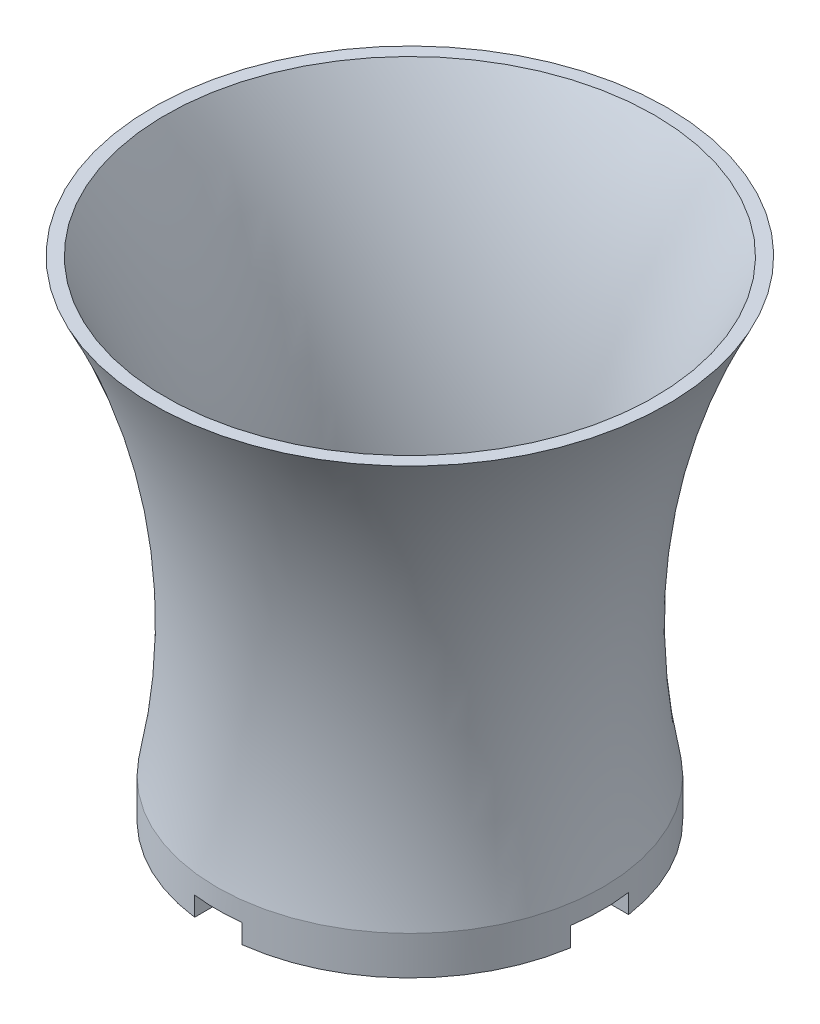
from build123d import *

# Parameters (mm, degrees)
F_9_64_0_14063_DIAMETER_HOLE2_D           = 3.572002
F_9_64_0_14063_DIAMETER_HOLE2_CSINK_D     = 4.842002
F_9_64_0_14063_DIAMETER_HOLE2_CSINK_ANGLE = 100
F_9_64_0_14063_DIAMETER_HOLE3_D           = 3.572002
F_9_64_0_14063_DIAMETER_HOLE3_CSINK_D     = 4.842002
F_9_64_0_14063_DIAMETER_HOLE3_CSINK_ANGLE = 100
CUT_EXTRUDE1_DEPTH                        = 3.81


with BuildPart() as part:
    # Sketch2 → Revolve1 (revolve)
    with BuildSketch(Plane.XY, mode=Mode.PRIVATE) as revolve1_sk:
        with BuildLine():
            Line((0, 0), (-35.56, 0))
            ThreePointArc((-35.56, 0), (-34.441376421, 45.516946226), (-48.26, 88.9))
            Line((-48.26, 88.9), (-50.8, 88.9))
            ThreePointArc((-50.8, 88.9), (-36.890578114, 45.529917412), (-38.1, 0))
            Line((-38.1, 0), (-38.1, -7.62))
            Line((-38.1, -7.62), (0, -7.62))
            Line((0, -7.62), (0, 0))
        make_face()
    revolve(revolve1_sk.sketch.rotate(Axis((0, 0, 0), (0, 1, 0)), 270), axis=Axis((0, 0, 0), (0, 1, 0)))

    # 9/64 (0.14063) Diameter Hole2 (through all)
    with Locations(Plane(origin=(0, 0, 0), x_dir=(1, 0, 0), z_dir=(0, 1, 0))):
        with Locations((0, -28.72641934), (-28.389650063, 0), (0, 28.72641934), (28.120234641, 0), (17.815094761, -20.105125845), (17.815094761, 19.431587291), (-18.421279459, 19.431587291), (-18.421279459, -20.105125845), (0, 0)):
            CounterSinkHole(F_9_64_0_14063_DIAMETER_HOLE2_D / 2, F_9_64_0_14063_DIAMETER_HOLE2_CSINK_D / 2, counter_sink_angle=F_9_64_0_14063_DIAMETER_HOLE2_CSINK_ANGLE)

    # 9/64 (0.14063) Diameter Hole3 (through all)
    with Locations(Plane(origin=(0, -7.62, 0), x_dir=(-1, 0, 0), z_dir=(0, -1, 0))):
        with Locations((-6.364939338, 18.960110303), (7.50995488, 18.960110303), (19.835710423, 7.914078013), (-19.29687958, 7.914078013), (-19.29687958, -8.385555001), (-7.038477892, -21.317495243), (7.914078013, -21.317495243), (19.835710423, -8.857031989)):
            CounterSinkHole(F_9_64_0_14063_DIAMETER_HOLE3_D / 2, F_9_64_0_14063_DIAMETER_HOLE3_CSINK_D / 2, counter_sink_angle=F_9_64_0_14063_DIAMETER_HOLE3_CSINK_ANGLE)

    # Sketch11 → Cut-Extrude1 (cut)
    with BuildSketch(Plane.XZ.offset(7.62)):
        with BuildLine():
            Line((-4.696611831, 37.809414665), (-4.696611831, 30.726938113))
            ThreePointArc((-4.696611831, 30.726938113), (-21.519829113, 22.429887281), (-30.506179441, 5.964554001))
            Line((-30.506179441, 5.964554001), (-37.630228482, 5.964554001))
            ThreePointArc((-37.630228482, 5.964554001), (-38.099253822, 0.238449554), (-37.701937681, -5.493077013))
            Line((-37.701937681, -5.493077013), (-30.594590918, -5.493077013))
            ThreePointArc((-30.594590918, -5.493077013), (-21.692260933, -22.263169229), (-4.696611831, -30.726938113))
            Line((-4.696611831, -30.726938113), (-4.696611831, -37.809414665))
            ThreePointArc((-4.696611831, -37.809414665), (0, -38.1), (4.696611831, -37.809414665))
            Line((4.696611831, -37.809414665), (4.696611831, -30.726938113))
            ThreePointArc((4.696611831, -30.726938113), (21.692260933, -22.263169229), (30.594590918, -5.493077013))
            Line((30.594590918, -5.493077013), (37.701937681, -5.493077013))
            ThreePointArc((37.701937681, -5.493077013), (38.099253822, 0.238449554), (37.630228482, 5.964554001))
            Line((37.630228482, 5.964554001), (30.506179441, 5.964554001))
            ThreePointArc((30.506179441, 5.964554001), (21.519829113, 22.429887281), (4.696611831, 30.726938113))
            Line((4.696611831, 30.726938113), (4.696611831, 37.809414665))
            ThreePointArc((4.696611831, 37.809414665), (0, 38.1), (-4.696611831, 37.809414665))
        make_face()
    extrude(amount=-CUT_EXTRUDE1_DEPTH, mode=Mode.SUBTRACT)


solid = part.part
